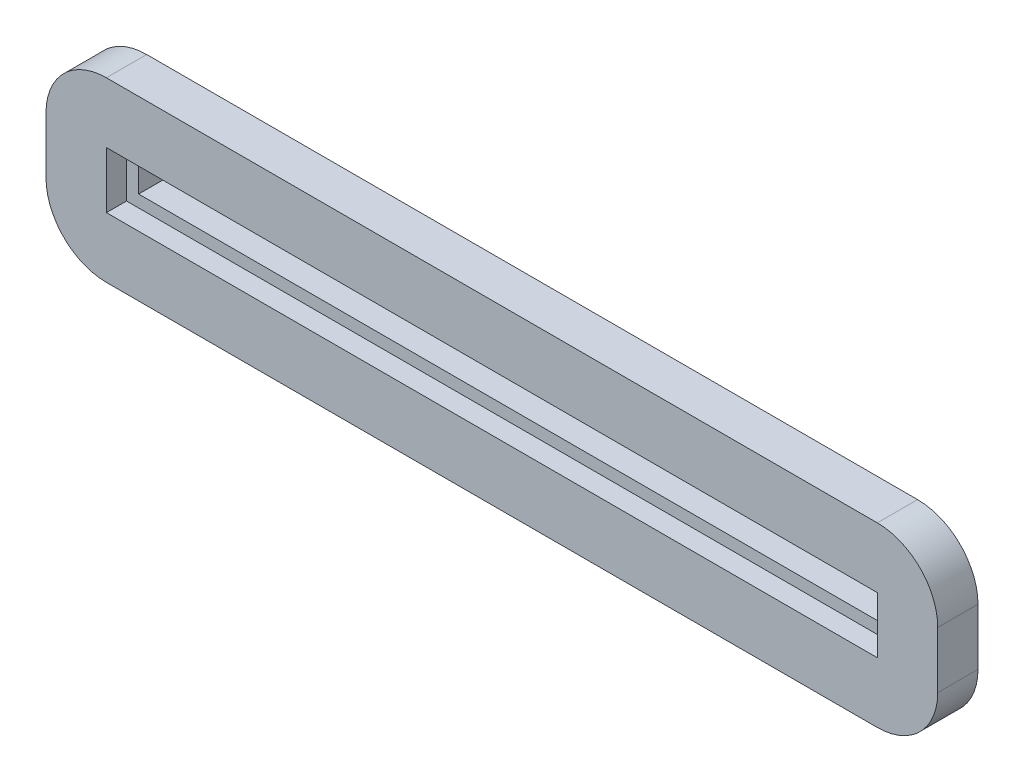
from build123d import *

# Parameters (mm, degrees)
ESQUISSE1_W             = 38.278150704
ESQUISSE1_H             = 2.8
BOSS_EXTRU_1_DEPTH      = 3
ESQUISSE2_W             = 37.078150704
ESQUISSE2_H             = 1.6
ENL_V_MAT_EXTRU_1_DEPTH = 2.5
BOSS_EXTRU_2_DEPTH      = 1
BOSS_EXTRU_2_DEPTH_BACK = 1
ESQUISSE3_W             = 38.278150704
ESQUISSE3_H             = 2.8


with BuildPart() as part:
    # Esquisse1 → Boss.-Extru.1 (new body)
    with BuildSketch(Plane.XY):
        with Locations((85.771739029, -17.999999993)):
            Rectangle(ESQUISSE1_W, ESQUISSE1_H)
    extrude(amount=BOSS_EXTRU_1_DEPTH)

    # Esquisse2 → Enlèv. mat.-Extru.1 (cut)
    with BuildSketch(Plane.XY.offset(3)):
        with Locations((85.771739029, -17.999999993)):
            Rectangle(ESQUISSE2_W, ESQUISSE2_H)
    extrude(amount=-ENL_V_MAT_EXTRU_1_DEPTH, mode=Mode.SUBTRACT)


with BuildPart() as body_2:
    # Esquisse3 → Boss.-Extru.2 (new, two sides: drawn at the far end of the back side and taken through both)
    with BuildSketch(Plane.XY.offset(3).offset(-BOSS_EXTRU_2_DEPTH_BACK)):
        with BuildLine():
            Line((104.910814381, -13.599999993), (66.632663677, -13.599999993))
            ThreePointArc((66.632663677, -13.599999993), (64.511343334, -14.478679649), (63.632663677, -16.599999993))
            Line((63.632663677, -16.599999993), (63.632663677, -19.399999993))
            ThreePointArc((63.632663677, -19.399999993), (64.511343334, -21.521320336), (66.632663677, -22.399999993))
            Line((66.632663677, -22.399999993), (104.910814381, -22.399999993))
            ThreePointArc((104.910814381, -22.399999993), (107.032134724, -21.521320336), (107.910814381, -19.399999993))
            Line((107.910814381, -19.399999993), (107.910814381, -16.599999993))
            ThreePointArc((107.910814381, -16.599999993), (107.032134724, -14.478679649), (104.910814381, -13.599999993))
        make_face()
        with Locations((85.771739029, -17.999999993)):
            Rectangle(ESQUISSE3_W, ESQUISSE3_H, mode=Mode.SUBTRACT)
    extrude(amount=BOSS_EXTRU_2_DEPTH + BOSS_EXTRU_2_DEPTH_BACK)


solid = Compound([part.part, body_2.part])
